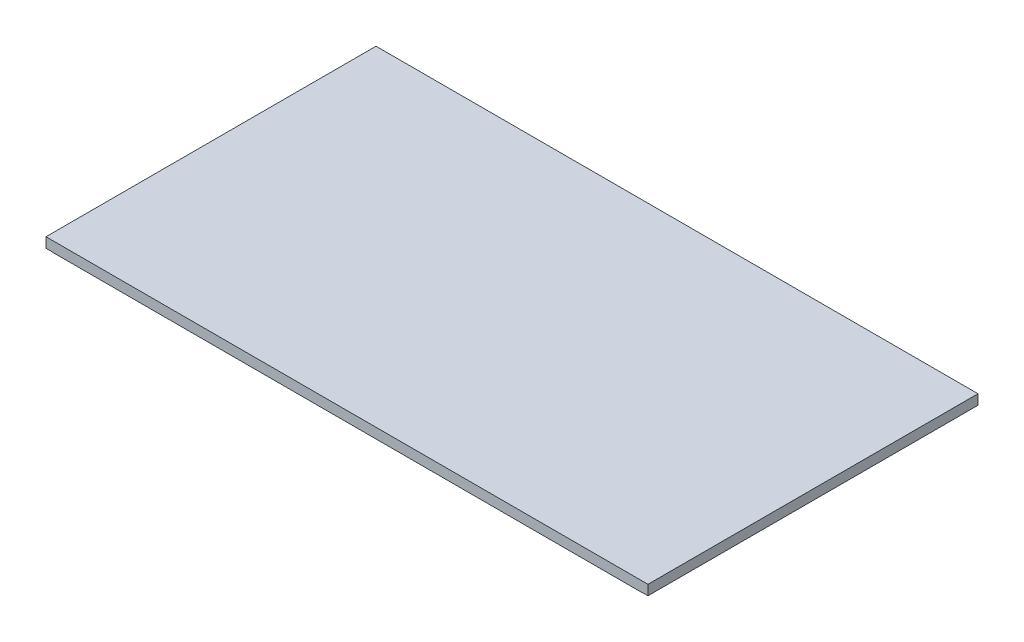
from build123d import *

# Parameters (mm, degrees)
BOSS_EXTRUDE1_DEPTH     = 5
CUT_EXTRUDE1_DEPTH      = 194.597682063
CUT_EXTRUDE1_DEPTH_BACK = 194.597682063
SKETCH2_W               = 116.5
SKETCH2_H               = 44
SKETCH3_W               = 6
SKETCH3_H               = 162
CUT_EXTRUDE2_DEPTH      = 0.1


with BuildPart() as part:
    # Sketch1 → Boss-Extrude1 (new body)
    with BuildSketch(Plane(origin=(0, 0, 0), x_dir=(1, 0, 0), z_dir=(0, 1, 0))):
        Polygon((-58.25, 125), (58.25, 125), (58.25, 81), (147.75, 81), (147.75, -81), (58.25, -81), (58.25, -125), (-58.25, -125), (-58.25, -81), (-147.75, -81), (-147.75, 81), (-58.25, 81), align=None)
    extrude(amount=BOSS_EXTRUDE1_DEPTH)

    # Sketch2 → Cut-Extrude1 (cut, two sides: drawn at the far end of the back side and taken through both)
    with BuildSketch(Plane.XZ.offset(-CUT_EXTRUDE1_DEPTH_BACK)):
        with Locations((0, 103)):
            Rectangle(SKETCH2_W, SKETCH2_H)
        with Locations((0, -103)):
            Rectangle(SKETCH2_W, SKETCH2_H)
    extrude(amount=CUT_EXTRUDE1_DEPTH + CUT_EXTRUDE1_DEPTH_BACK, mode=Mode.SUBTRACT)

    # Sketch3 → Cut-Extrude2 (cut)
    with BuildSketch(Plane.XZ):
        with Locations((-147.75, 0)):
            Rectangle(SKETCH3_W, SKETCH3_H)
        with Locations((147.75, 0)):
            Rectangle(SKETCH3_W, SKETCH3_H)
    extrude(amount=-CUT_EXTRUDE2_DEPTH, mode=Mode.SUBTRACT)


solid = part.part
